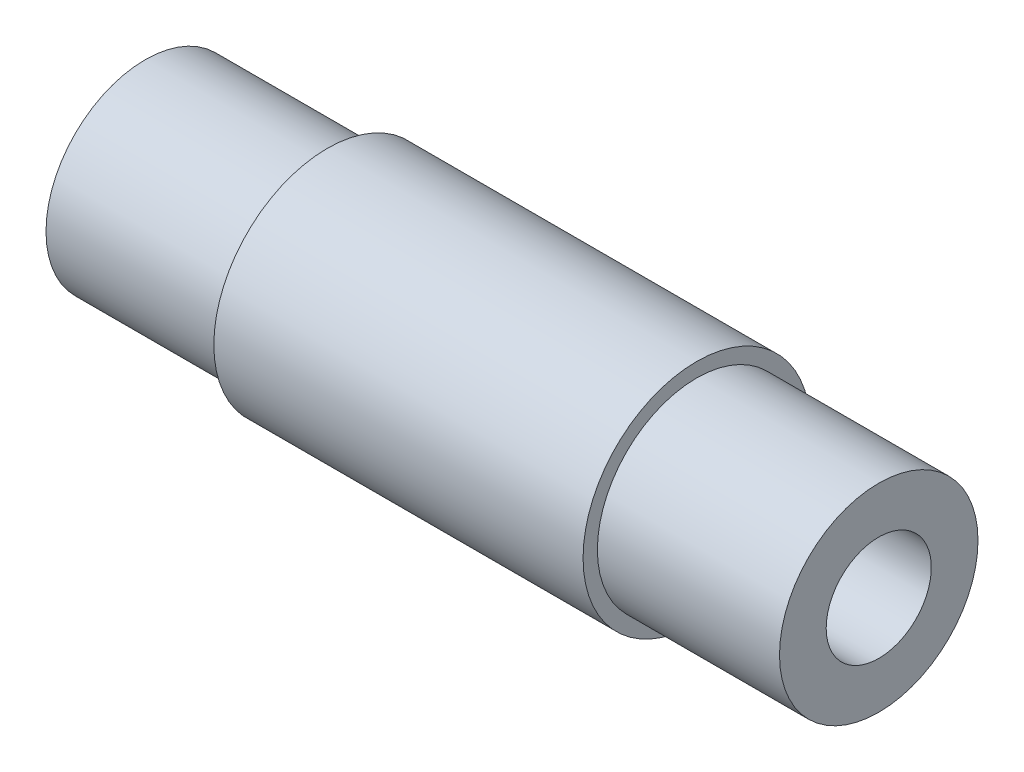
from build123d import *

# Parameters (mm, degrees)
SOCKET_1_SKETCH_W = 23.9
SOCKET_1_SKETCH_H = 6.35
SOCKET_2_SKETCH_W = 23.9
SOCKET_2_SKETCH_H = 6.35


with BuildPart() as part:
    # Filter_F1 Sketch → Filter_F1 (revolve)
    with BuildSketch(Plane.XY):
        Polygon((-44.3, 0), (-44.3, 11.988), (-22.3, 11.988), (-22.3, 13.716), (22.3, 13.716), (22.3, 11.988), (44.3, 11.988), (44.3, 0), align=None)
    revolve(axis=Axis((-1000, 0, 0), (1, 0, 0)))

    # Socket 1 Sketch → Socket 1 (revolve, cut)
    with BuildSketch(Plane.XY):
        with Locations((-33.35, 3.175)):
            Rectangle(SOCKET_1_SKETCH_W, SOCKET_1_SKETCH_H)
    revolve(axis=Axis((-1000, 0, 0), (1, 0, 0)), mode=Mode.SUBTRACT)

    # Socket 2 Sketch → Socket 2 (revolve, cut)
    with BuildSketch(Plane.XY):
        with Locations((33.35, 3.175)):
            Rectangle(SOCKET_2_SKETCH_W, SOCKET_2_SKETCH_H)
    revolve(axis=Axis((-1000, 0, 0), (1, 0, 0)), mode=Mode.SUBTRACT)


solid = part.part
